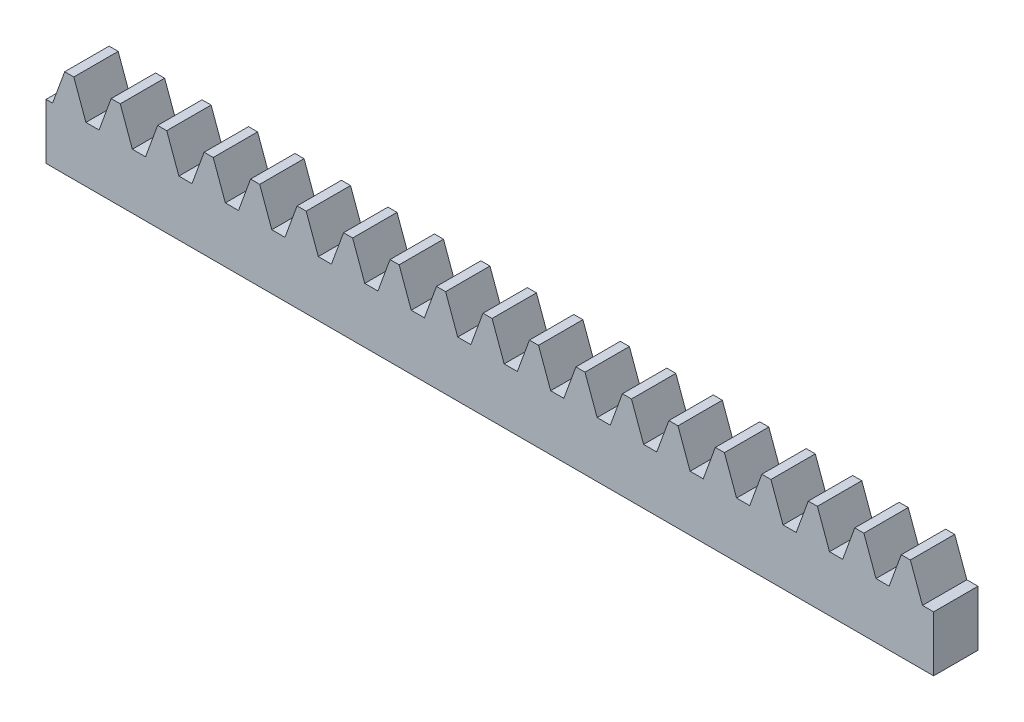
from build123d import *

# Parameters (mm, degrees)
BLANKSKE_W        = 60
BLANKSKE_H        = 6
BLANK_DEPTH       = 3
TOOTHCUTSIM_DEPTH = 61.373835392
TEETHCUTS_COUNT   = 21
TEETHCUTS_PITCH   = 3.14159265


with BuildPart() as part:
    # BlankSke → Blank (new body)
    with BuildSketch(Plane.XY):
        with Locations((30, 3)):
            Rectangle(BLANKSKE_W, BLANKSKE_H)
    extrude(amount=-BLANK_DEPTH)

    # TooCutSkeSim → ToothCutSim (cut, through all)
    with BuildSketch(Plane.XY):
        Polygon((0.44443537, 3.75), (-0.44443537, 3.75), (-1.272613241, 6.0254), (1.272613241, 6.0254), align=None)
    toothcutsim = extrude(amount=-TOOTHCUTSIM_DEPTH, mode=Mode.SUBTRACT)

    # TeethCuts: ToothCutSim ×21
    with Locations(*[(i * TEETHCUTS_PITCH, 0, 0) for i in range(1, TEETHCUTS_COUNT)]):
        add(toothcutsim, mode=Mode.SUBTRACT)


solid = part.part
